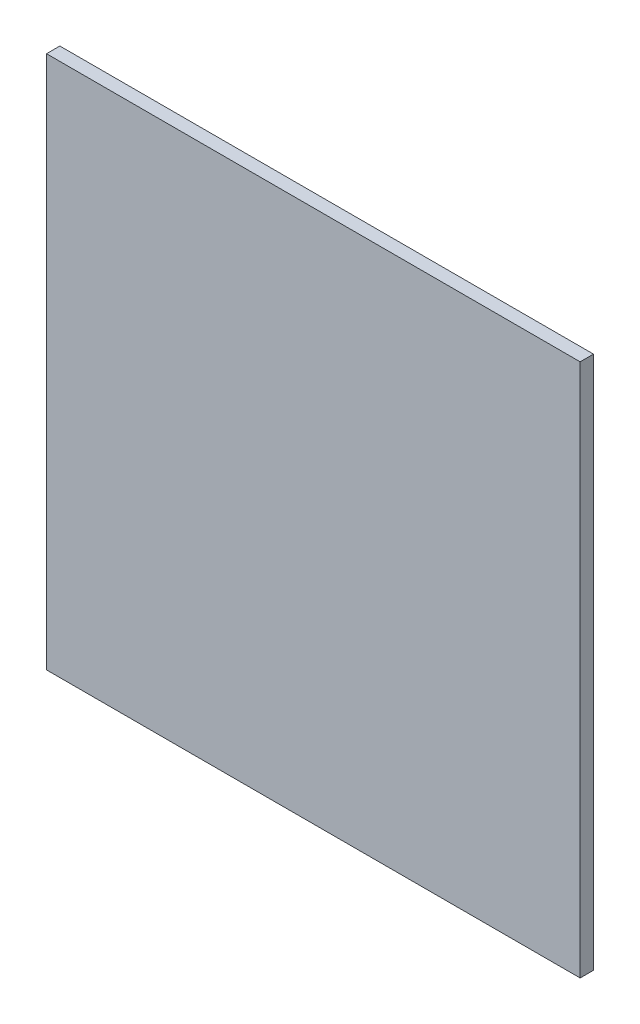
from build123d import *

# Parameters (mm, degrees)
SKETCH_3_W      = 4000
SKETCH_3_H      = 4000
EXTRUDE_2_DEPTH = 100


with BuildPart() as part:
    # 草图3 → 凸台-拉伸2 (new body)
    with BuildSketch(Plane.XY):
        with Locations((2000, 2000)):
            Rectangle(SKETCH_3_W, SKETCH_3_H)
    extrude(amount=-EXTRUDE_2_DEPTH)


solid = part.part
